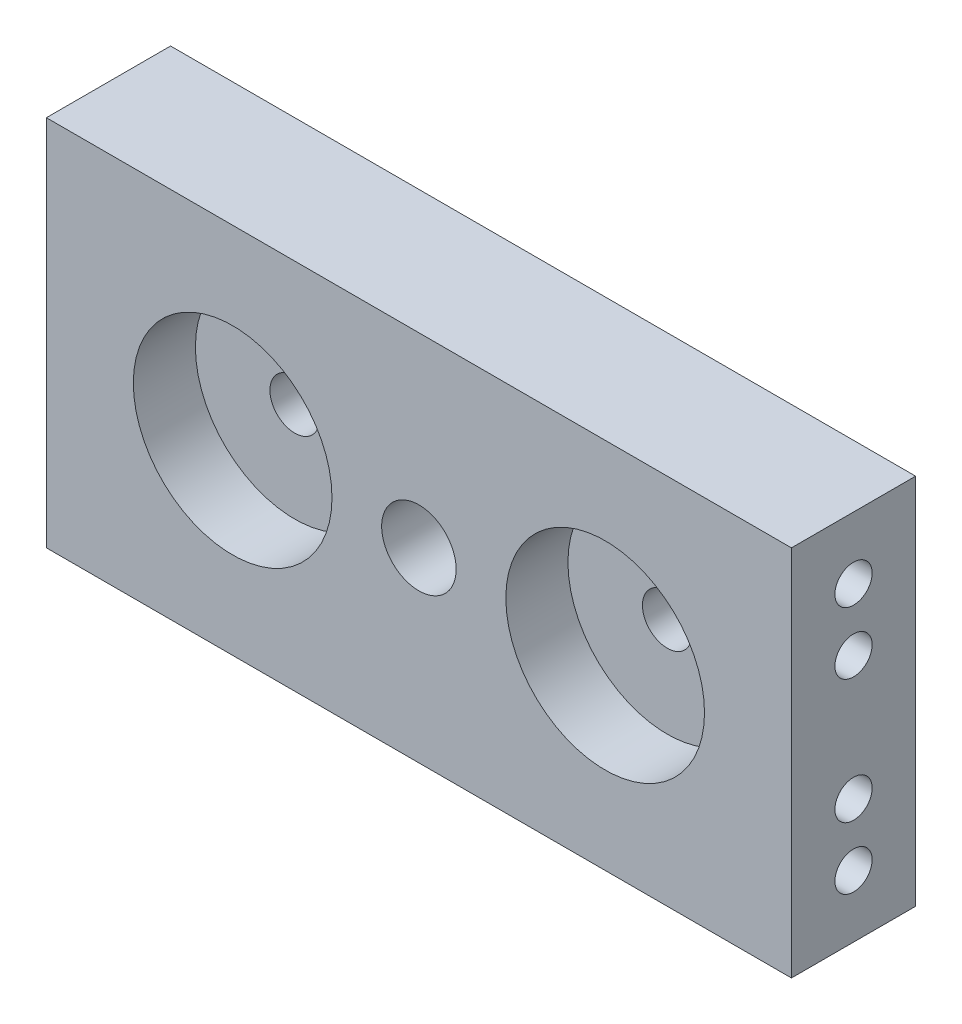
from build123d import *

# Parameters (mm, degrees)
SKETCH1_W           = 120
SKETCH1_H           = 60
BOSS_EXTRUDE1_DEPTH = 20
SKETCH2_R           = 4
SKETCH2_R_2         = 6
CUT_EXTRUDE1_DEPTH  = 20
SKETCH3_R           = 16
SKETCH3_R_2         = 4
CUT_EXTRUDE2_DEPTH  = 10
SKETCH4_R           = 3
CUT_EXTRUDE4_DEPTH  = 10
CUT_EXTRUDE5_START  = -10
SKETCH5_R           = 3
CUT_EXTRUDE5_DEPTH  = 10


with BuildPart() as part:
    # Sketch1 → Boss-Extrude1 (new body)
    with BuildSketch(Plane.XY):
        with Locations((60, -30)):
            Rectangle(SKETCH1_W, SKETCH1_H)
    extrude(amount=BOSS_EXTRUDE1_DEPTH)

    # Sketch2 → Cut-Extrude1 (cut)
    with BuildSketch(Plane.XY.offset(20)):
        with Locations((30, -30)):
            Circle(SKETCH2_R)
        with Locations((60, -30)):
            Circle(SKETCH2_R_2)
        with Locations((90, -30)):
            Circle(SKETCH2_R)
    extrude(amount=-CUT_EXTRUDE1_DEPTH, mode=Mode.SUBTRACT)

    # Sketch3 → Cut-Extrude2 (cut)
    # profile 1 of 2: a face of its own
    with BuildSketch(Plane.XY.offset(20)):
        with Locations((30, -30)):
            Circle(SKETCH3_R)
        with Locations((30, -30)):
            Circle(SKETCH3_R_2, mode=Mode.SUBTRACT)
    # profile 2 of 2: a face of its own
    with BuildSketch(Plane.XY.offset(20)):
        with Locations((90, -30)):
            Circle(SKETCH3_R)
        with Locations((90, -30)):
            Circle(SKETCH3_R_2, mode=Mode.SUBTRACT)
    extrude(amount=-CUT_EXTRUDE2_DEPTH, mode=Mode.SUBTRACT)

    # Sketch4 → Cut-Extrude4 (cut)
    with BuildSketch(Plane(origin=(120, 0, 0), x_dir=(0, 0, -1), z_dir=(1, 0, 0))):
        with Locations(Location((-10, -10, 0), (0, 0, 90))):
            Circle(SKETCH4_R)
        with Locations(Location((-10, -20, 0), (0, 0, 90))):
            Circle(SKETCH4_R)
        with Locations(Location((-10, -40, 0), (0, 0, 90))):
            Circle(SKETCH4_R)
        with Locations(Location((-10, -50, 0), (0, 0, 90))):
            Circle(SKETCH4_R)
    extrude(amount=-CUT_EXTRUDE4_DEPTH, mode=Mode.SUBTRACT)

    # Sketch5 → Cut-Extrude5 (cut)
    with BuildSketch(Plane.ZY.offset(CUT_EXTRUDE5_START)):
        with Locations(Location((10, -10, 0), (0, 0, 90))):
            Circle(SKETCH5_R)
        with Locations(Location((10, -20, 0), (0, 0, 90))):
            Circle(SKETCH5_R)
        with Locations(Location((10, -40, 0), (0, 0, 90))):
            Circle(SKETCH5_R)
        with Locations(Location((10, -50, 0), (0, 0, 90))):
            Circle(SKETCH5_R)
    extrude(amount=CUT_EXTRUDE5_DEPTH, mode=Mode.SUBTRACT)


solid = part.part
